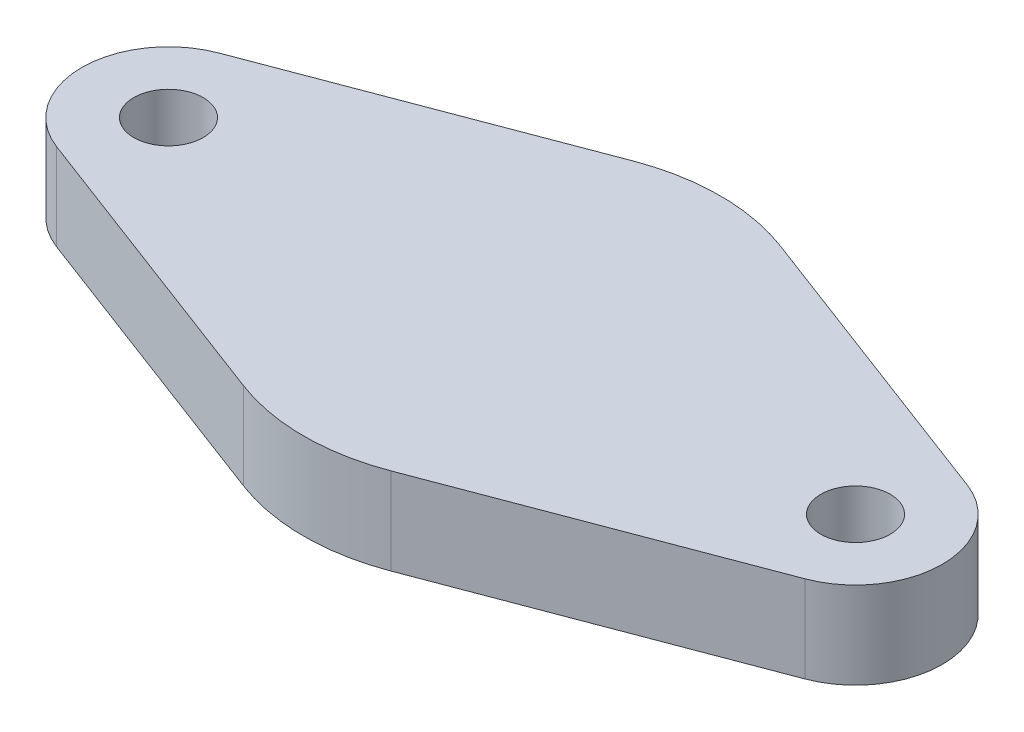
from build123d import *

# Parameters (mm, degrees)
SKETCH1_R           = 2
BOSS_EXTRUDE2_DEPTH = 5


with BuildPart() as part:
    # Sketch1 → Boss-Extrude2 (new body)
    with BuildSketch(Plane(origin=(0, 0, 0), x_dir=(1, 0, 0), z_dir=(0, 1, 0))):
        with BuildLine():
            Line((-21.567676768, 4.677105819), (-4.242424242, 11.225053966))
            ThreePointArc((-4.242424242, 11.225053966), (0, 12), (4.242424242, 11.225053966))
            Line((4.242424242, 11.225053966), (21.567676768, 4.677105819))
            ThreePointArc((21.567676768, 4.677105819), (24.8, 0), (21.567676768, -4.677105819))
            Line((21.567676768, -4.677105819), (4.242424242, -11.225053966))
            ThreePointArc((4.242424242, -11.225053966), (0, -12), (-4.242424242, -11.225053966))
            Line((-4.242424242, -11.225053966), (-21.567676768, -4.677105819))
            ThreePointArc((-21.567676768, -4.677105819), (-24.8, 0), (-21.567676768, 4.677105819))
        make_face()
        with Locations(Location((-19.8, 0, 0), (0, 0, 270))):
            Circle(SKETCH1_R, mode=Mode.SUBTRACT)
        with Locations(Location((19.8, 0, 0), (0, 0, 90))):
            Circle(SKETCH1_R, mode=Mode.SUBTRACT)
    extrude(amount=BOSS_EXTRUDE2_DEPTH)


solid = part.part
